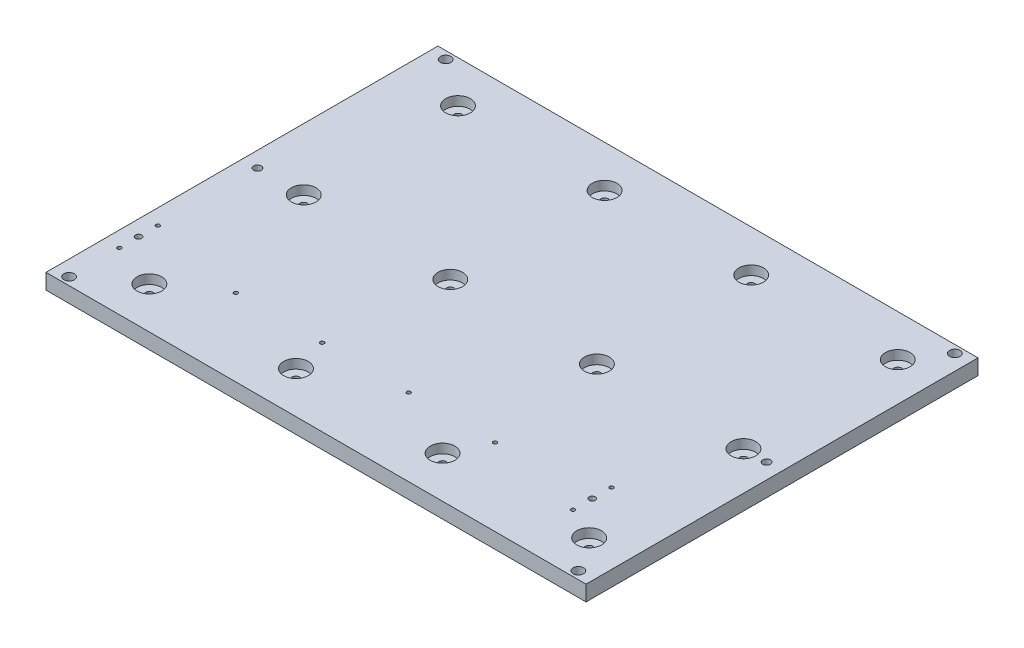
from build123d import *

# Parameters (mm, degrees)
SKETCH2_W           = 920
SKETCH2_H           = 264
BOSS_EXTRUDE1_DEPTH = 10
SKETCH1_R           = 2.5
CUT_EXTRUDE2_DEPTH  = 18
SKETCH3_R           = 8
CUT_EXTRUDE3_DEPTH  = 6
SKETCH4_W           = 570
SKETCH4_H           = 264
CUT_EXTRUDE4_DEPTH  = 20
SKETCH7_R           = 3.4
SKETCH7_R_2         = 2.5
CUT_EXTRUDE5_DEPTH  = 20
SKETCH8_W           = 350
SKETCH8_H           = 5
CUT_EXTRUDE6_DEPTH  = 10
SKETCH9_R           = 1.25
SKETCH9_R_2         = 2
CUT_EXTRUDE7_DEPTH  = 10


with BuildPart() as part:
    # Sketch2 → Boss-Extrude1 (new body)
    with BuildSketch(Plane(origin=(0, 0, 0), x_dir=(1, 0, 0), z_dir=(0, 1, 0))):
        with Locations((460, 132)):
            Rectangle(SKETCH2_W, SKETCH2_H)
    extrude(amount=BOSS_EXTRUDE1_DEPTH)

    # Sketch1 → Cut-Extrude2 (cut)
    with BuildSketch(Plane(origin=(0, 10, 0), x_dir=(1, 0, 0), z_dir=(0, 1, 0))):
        with Locations(Location((40, 32, 0), (0, 0, 270))):
            Circle(SKETCH1_R)
        with Locations(Location((135, 32, 0), (0, 0, 270))):
            Circle(SKETCH1_R)
        with Locations(Location((230, 32, 0), (0, 0, 270))):
            Circle(SKETCH1_R)
        with Locations(Location((325, 32, 0), (0, 0, 270))):
            Circle(SKETCH1_R)
        with Locations(Location((420, 32, 0), (0, 0, 270))):
            Circle(SKETCH1_R)
        with Locations(Location((515, 32, 0), (0, 0, 270))):
            Circle(SKETCH1_R)
        with Locations(Location((610, 32, 0), (0, 0, 270))):
            Circle(SKETCH1_R)
        with Locations(Location((705, 32, 0), (0, 0, 270))):
            Circle(SKETCH1_R)
        with Locations(Location((800, 32, 0), (0, 0, 270))):
            Circle(SKETCH1_R)
        with Locations(Location((895, 32, 0), (0, 0, 270))):
            Circle(SKETCH1_R)
        with Locations(Location((135, 132, 0), (0, 0, 270))):
            Circle(SKETCH1_R)
        with Locations(Location((230, 132, 0), (0, 0, 270))):
            Circle(SKETCH1_R)
        with Locations(Location((325, 132, 0), (0, 0, 270))):
            Circle(SKETCH1_R)
        with Locations(Location((420, 132, 0), (0, 0, 270))):
            Circle(SKETCH1_R)
        with Locations(Location((515, 132, 0), (0, 0, 270))):
            Circle(SKETCH1_R)
        with Locations(Location((610, 132, 0), (0, 0, 270))):
            Circle(SKETCH1_R)
        with Locations(Location((705, 132, 0), (0, 0, 270))):
            Circle(SKETCH1_R)
        with Locations(Location((800, 132, 0), (0, 0, 270))):
            Circle(SKETCH1_R)
        with Locations(Location((895, 132, 0), (0, 0, 270))):
            Circle(SKETCH1_R)
        with Locations(Location((135, 232, 0), (0, 0, 270))):
            Circle(SKETCH1_R)
        with Locations(Location((230, 232, 0), (0, 0, 270))):
            Circle(SKETCH1_R)
        with Locations(Location((325, 232, 0), (0, 0, 270))):
            Circle(SKETCH1_R)
        with Locations(Location((420, 232, 0), (0, 0, 270))):
            Circle(SKETCH1_R)
        with Locations(Location((515, 232, 0), (0, 0, 270))):
            Circle(SKETCH1_R)
        with Locations(Location((610, 232, 0), (0, 0, 270))):
            Circle(SKETCH1_R)
        with Locations(Location((705, 232, 0), (0, 0, 270))):
            Circle(SKETCH1_R)
        with Locations(Location((800, 232, 0), (0, 0, 270))):
            Circle(SKETCH1_R)
        with Locations(Location((895, 232, 0), (0, 0, 270))):
            Circle(SKETCH1_R)
        with Locations(Location((40, 132, 0), (0, 0, 270))):
            Circle(SKETCH1_R)
        with Locations(Location((40, 232, 0), (0, 0, 270))):
            Circle(SKETCH1_R)
    extrude(amount=-CUT_EXTRUDE2_DEPTH, mode=Mode.SUBTRACT)

    # Sketch3 → Cut-Extrude3 (cut)
    with BuildSketch(Plane(origin=(0, 10, 0), x_dir=(1, 0, 0), z_dir=(0, 1, 0))):
        with Locations(Location((40, 32, 0), (0, 0, 270))):
            Circle(SKETCH3_R)
        with Locations(Location((135, 32, 0), (0, 0, 270))):
            Circle(SKETCH3_R)
        with Locations(Location((230, 32, 0), (0, 0, 270))):
            Circle(SKETCH3_R)
        with Locations(Location((325, 32, 0), (0, 0, 270))):
            Circle(SKETCH3_R)
        with Locations(Location((420, 32, 0), (0, 0, 270))):
            Circle(SKETCH3_R)
        with Locations(Location((515, 32, 0), (0, 0, 270))):
            Circle(SKETCH3_R)
        with Locations(Location((610, 32, 0), (0, 0, 270))):
            Circle(SKETCH3_R)
        with Locations(Location((705, 32, 0), (0, 0, 270))):
            Circle(SKETCH3_R)
        with Locations(Location((800, 32, 0), (0, 0, 270))):
            Circle(SKETCH3_R)
        with Locations(Location((895, 32, 0), (0, 0, 270))):
            Circle(SKETCH3_R)
        with Locations(Location((135, 132, 0), (0, 0, 270))):
            Circle(SKETCH3_R)
        with Locations(Location((230, 132, 0), (0, 0, 270))):
            Circle(SKETCH3_R)
        with Locations(Location((325, 132, 0), (0, 0, 270))):
            Circle(SKETCH3_R)
        with Locations(Location((420, 132, 0), (0, 0, 270))):
            Circle(SKETCH3_R)
        with Locations(Location((515, 132, 0), (0, 0, 270))):
            Circle(SKETCH3_R)
        with Locations(Location((610, 132, 0), (0, 0, 270))):
            Circle(SKETCH3_R)
        with Locations(Location((705, 132, 0), (0, 0, 270))):
            Circle(SKETCH3_R)
        with Locations(Location((800, 132, 0), (0, 0, 270))):
            Circle(SKETCH3_R)
        with Locations(Location((895, 132, 0), (0, 0, 270))):
            Circle(SKETCH3_R)
        with Locations(Location((135, 232, 0), (0, 0, 270))):
            Circle(SKETCH3_R)
        with Locations(Location((230, 232, 0), (0, 0, 270))):
            Circle(SKETCH3_R)
        with Locations(Location((325, 232, 0), (0, 0, 270))):
            Circle(SKETCH3_R)
        with Locations(Location((420, 232, 0), (0, 0, 270))):
            Circle(SKETCH3_R)
        with Locations(Location((515, 232, 0), (0, 0, 270))):
            Circle(SKETCH3_R)
        with Locations(Location((610, 232, 0), (0, 0, 270))):
            Circle(SKETCH3_R)
        with Locations(Location((705, 232, 0), (0, 0, 270))):
            Circle(SKETCH3_R)
        with Locations(Location((800, 232, 0), (0, 0, 270))):
            Circle(SKETCH3_R)
        with Locations(Location((895, 232, 0), (0, 0, 270))):
            Circle(SKETCH3_R)
        with Locations(Location((40, 132, 0), (0, 0, 270))):
            Circle(SKETCH3_R)
        with Locations(Location((40, 232, 0), (0, 0, 270))):
            Circle(SKETCH3_R)
    extrude(amount=-CUT_EXTRUDE3_DEPTH, mode=Mode.SUBTRACT)

    # Sketch4 → Cut-Extrude4 (cut)
    with BuildSketch(Plane(origin=(0, 10, 0), x_dir=(1, 0, 0), z_dir=(0, 1, 0))):
        with Locations((635, 132)):
            Rectangle(SKETCH4_W, SKETCH4_H)
    extrude(amount=-CUT_EXTRUDE4_DEPTH, mode=Mode.SUBTRACT)

    # Sketch7 → Cut-Extrude5 (cut)
    with BuildSketch(Plane(origin=(0, 10, 0), x_dir=(1, 0, 0), z_dir=(0, 1, 0))):
        with Locations(Location((10, 254, 0), (0, 0, 270))):
            Circle(SKETCH7_R)
        with Locations(Location((340, 254, 0), (0, 0, 270))):
            Circle(SKETCH7_R)
        with Locations(Location((340, 10, 0), (0, 0, 270))):
            Circle(SKETCH7_R)
        with Locations(Location((10, 10, 0), (0, 0, 270))):
            Circle(SKETCH7_R)
        with Locations(Location((10, 132, 0), (0, 0, 270))):
            Circle(SKETCH7_R_2)
        with Locations(Location((340, 132, 0), (0, 0, 270))):
            Circle(SKETCH7_R_2)
    extrude(amount=-CUT_EXTRUDE5_DEPTH, mode=Mode.SUBTRACT)

    # Sketch8 → Cut-Extrude6 (cut)
    with BuildSketch(Plane(origin=(0, 10, 0), x_dir=(1, 0, 0), z_dir=(0, 1, 0))):
        with Locations((175, 261.5)):
            Rectangle(SKETCH8_W, SKETCH8_H)
        with Locations((175, 2.5)):
            Rectangle(SKETCH8_W, SKETCH8_H)
    extrude(amount=-CUT_EXTRUDE6_DEPTH, mode=Mode.SUBTRACT)

    # Sketch9 → Cut-Extrude7 (cut)
    with BuildSketch(Plane(origin=(0, 10, 0), x_dir=(1, 0, 0), z_dir=(0, 1, 0))):
        with Locations(Location((10, 67.5, 0), (0, 0, 270))):
            Circle(SKETCH9_R)
        with Locations(Location((10, 42.5, 0), (0, 0, 270))):
            Circle(SKETCH9_R)
        with Locations(Location((304, 67.5, 0), (0, 0, 90))):
            Circle(SKETCH9_R)
        with Locations(Location((304, 42.5, 0), (0, 0, 90))):
            Circle(SKETCH9_R)
        with Locations(Location((73, 55, 0), (0, 0, 270))):
            Circle(SKETCH9_R)
        with Locations(Location((129, 55, 0), (0, 0, 270))):
            Circle(SKETCH9_R)
        with Locations(Location((185, 55, 0), (0, 0, 90))):
            Circle(SKETCH9_R)
        with Locations(Location((241, 55, 0), (0, 0, 90))):
            Circle(SKETCH9_R)
        with Locations(Location((10, 55, 0), (0, 0, 270))):
            Circle(SKETCH9_R_2)
        with Locations(Location((304, 55, 0), (0, 0, 90))):
            Circle(SKETCH9_R_2)
    extrude(amount=-CUT_EXTRUDE7_DEPTH, mode=Mode.SUBTRACT)


solid = part.part
